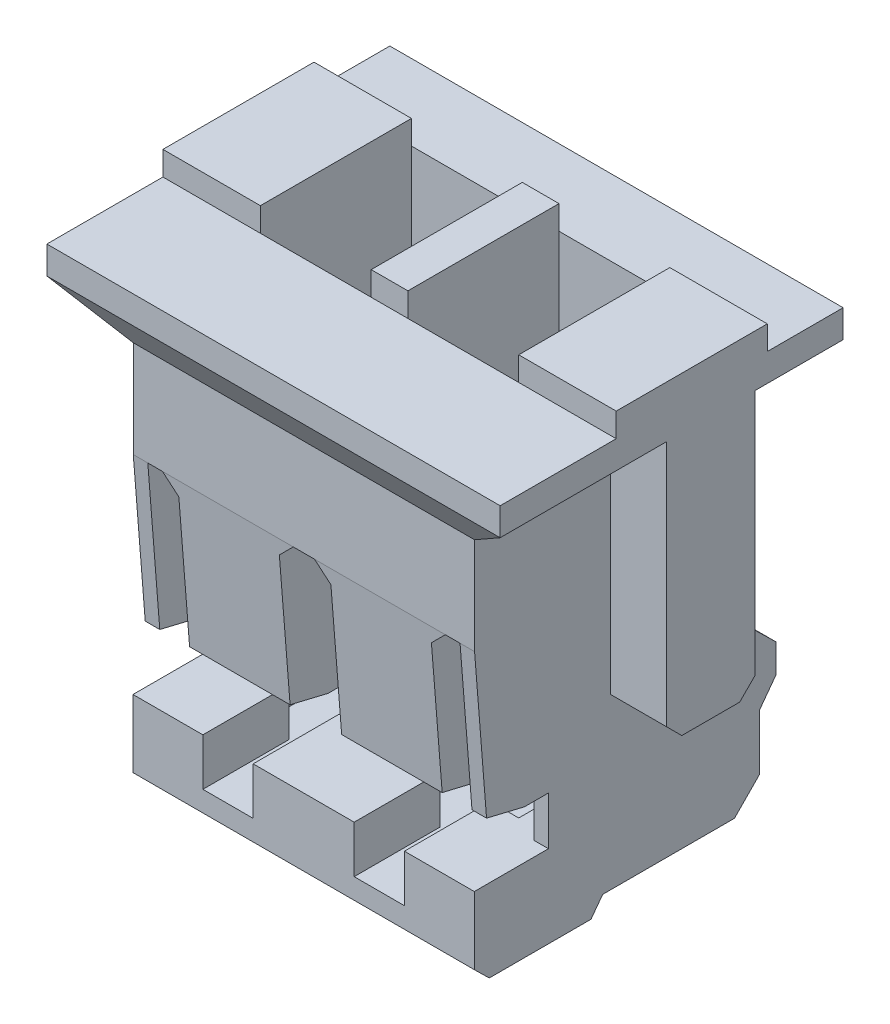
from build123d import *

# Parameters (mm, degrees)
EXTRUDE_1_DEPTH     = 2.25
SKETCH_2_W          = 1.1
SKETCH_2_H          = 0.473559538
SKETCH_2_W_2        = 0.498992391
SKETCH_2_H_2        = 0.307326439
CUT_EXTRUDE_1_DEPTH = 1.5
SKETCH_5_W          = 1.1
SKETCH_5_H          = 0.237770676
CUT_EXTRUDE_3_DEPTH = 6.633027066
EXTRUDE_2_DEPTH     = 2.25
SKETCH_4_W          = 1.1
SKETCH_4_H          = 1.5
CUT_EXTRUDE_2_DEPTH = 4.212970342
SKETCH_6_W          = 0.997822092
SKETCH_6_H          = 0.479381763
CUT_EXTRUDE_4_DEPTH = 0.2
SKETCH_7_W          = 0.498992391
SKETCH_7_H          = 0.468620273
CUT_EXTRUDE_5_DEPTH = 7.143885496


with BuildPart() as part:
    # 草图1 → 凸台-拉伸1 (new body)
    with BuildSketch(Plane(origin=(0, 0, 0), x_dir=(0, 0, -1), z_dir=(1, 0, 0))):
        Polygon((0, 4.562229324), (1.151979455, 4.562229324), (1.151979455, 4.8), (2.651979455, 4.8), (2.651979455, 4.562229324), (3.404860606, 4.562229324), (3.404860606, 4.287187795), (3.071666363, 3.838301107), (3.071666363, 1.684829824), (3.295234427, 1.465740305), (3.295234427, 1.184498299), (3.132388227, 0.96510828), (3.132388227, 0.411082783), (2.882381357, 0.155965368), (1.573428318, 0.155965368), (1.457660209, 0), (0.448123395, 0), (0.299248107, 0.145892998), (0.299248107, 0.817879256), (1.035254024, 0.817879256), (1.035254024, 1.297261019), (0.797343028, 1.297261019), (0.420679628, 1.387660235), (0.301921402, 2.879247301), (0.301921402, 3.840575896), (0, 4.287187795), align=None)
        Polygon((1.652980181, 1.834829824), (1.802980181, 1.684829824), (2.377591251, 1.684829824), (2.527591251, 1.834829824), (2.527591251, 4.287187795), (1.652980181, 4.287187795), align=None, mode=Mode.SUBTRACT)
    extrude(amount=EXTRUDE_1_DEPTH)

    # 草图2 → 切除-拉伸1 (cut)
    with BuildSketch(Plane.XY):
        Polygon((2.25, 4.287187795), (1.694149292, 3.840575896), (1.694149292, 2.879247301), (1.694149292, 0.817879256), (1.694149292, 0), (2.25, 0), align=None)
        with Locations((0.732254764, 4.799009093)):
            Rectangle(SKETCH_2_W, SKETCH_2_H)
        Polygon((1.253711529, 2.729247301), (1.253711529, 0.817879256), (1.403711529, 0.817879256), (1.549770068, 0.817879256), (1.549770068, 2.879247301), (1.403711529, 2.879247301), align=None)
        Polygon((0, 2.879247301), (0.105889437, 2.879247301), (0.255889437, 2.729247301), (0.255889437, 0.817879256), (0, 0.817879256), align=None)
        with Locations((0.750944102, 0.502922202)):
            Rectangle(SKETCH_2_W_2, SKETCH_2_H_2)
    extrude(amount=-CUT_EXTRUDE_1_DEPTH, mode=Mode.SUBTRACT)

    # 草图5 → 切除-拉伸3 (cut, through all)
    with BuildSketch(Plane.XY.offset(-1.5)):
        with Locations((0.732254764, 4.681114662)):
            Rectangle(SKETCH_5_W, SKETCH_5_H)
        Polygon((2.25, 0.057041107), (2.25, 4.287187795), (1.694149292, 3.840575896), (1.694149292, 0.057041107), align=None)
    extrude(amount=-CUT_EXTRUDE_3_DEPTH, mode=Mode.SUBTRACT)

    # 草图3 → 凸台-拉伸2 (add)
    with BuildSketch(Plane.ZY):
        Polygon((-1.652980181, 4.287187795), (-1.652980181, 1.834829824), (-1.802980181, 1.684829824), (-2.377591251, 1.684829824), (-2.527591251, 1.834829824), (-2.527591251, 4.287187795), align=None)
    extrude(amount=-EXTRUDE_2_DEPTH)

    # 草图4 → 切除-拉伸2 (cut)
    with BuildSketch(Plane(origin=(0, 4.562229324, 0), x_dir=(1, 0, 0), z_dir=(0, 1, 0))):
        with Locations((0.732254764, 1.901979455)):
            Rectangle(SKETCH_4_W, SKETCH_4_H)
    extrude(amount=-CUT_EXTRUDE_2_DEPTH, mode=Mode.SUBTRACT)

    # 草图6 → 切除-拉伸4 (cut)
    with BuildSketch(Plane.XY.offset(-1.035254024)):
        with Locations((0.754800483, 1.057570137)):
            Rectangle(SKETCH_6_W, SKETCH_6_H)
    extrude(amount=-CUT_EXTRUDE_4_DEPTH, mode=Mode.SUBTRACT)

    # 草图7 → 切除-拉伸5 (cut, through all)
    with BuildSketch(Plane.XY.offset(-0.299248107)):
        with Locations((0.750944102, 0.58356912)):
            Rectangle(SKETCH_7_W, SKETCH_7_H)
    extrude(amount=-CUT_EXTRUDE_5_DEPTH, mode=Mode.SUBTRACT)

    # 镜向1: part across face


with BuildPart() as part_1:
    add(part.part)
    add(part.part.mirror(Plane(origin=(0, 2.559271295, -1.883517387), x_dir=(0, 0, 1), z_dir=(-1, 0, 0))))


solid = part_1.part
